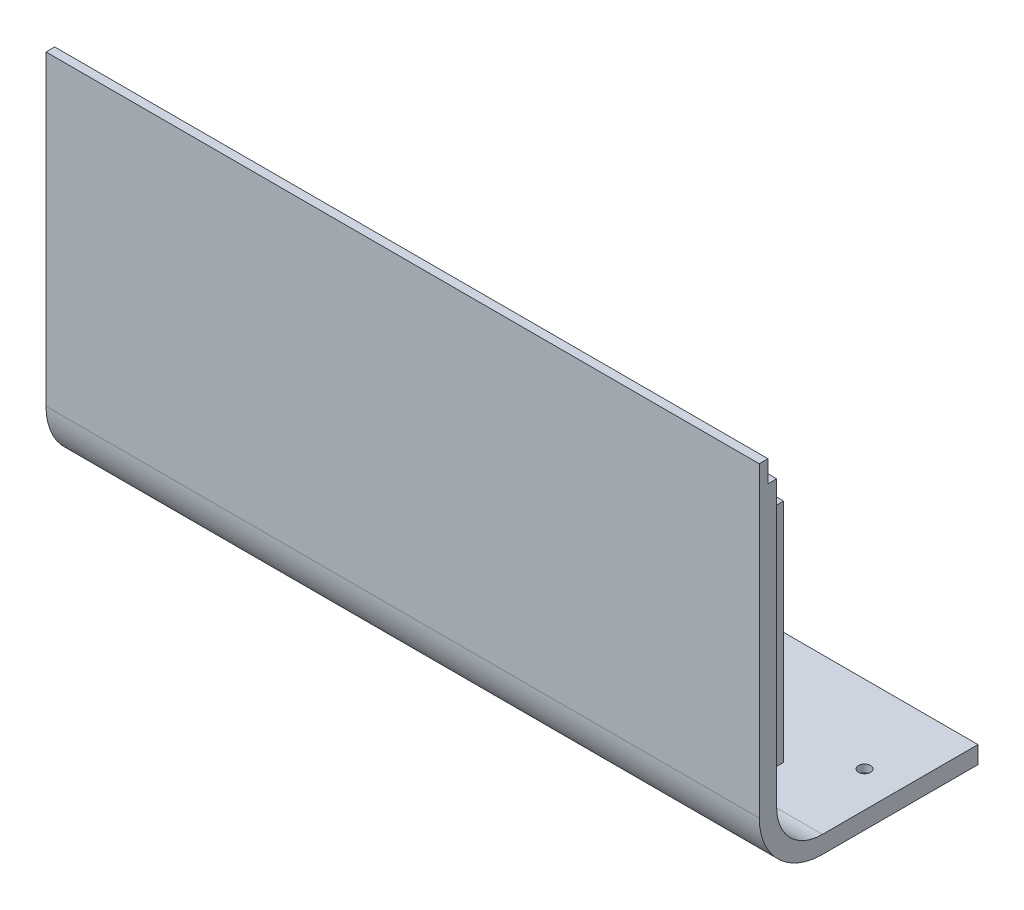
from build123d import *

# Parameters (mm, degrees)
SALIENTE_EXTRUIR1_DEPTH    = 131.1
CROQUIS3_R                 = 1.1
CORTAR_EXTRUIR1_DEPTH      = 289.575068223
CROQUIS4_R                 = 10.7
CROQUIS4_R_2               = 5.07
CROQUIS4_W                 = 121.1
CROQUIS4_H                 = 75.8
CROQUIS4_W_2               = 1.6
CROQUIS4_H_2               = 10
CROQUIS4_W_3               = 10
CROQUIS4_H_3               = 10.6
CORTAR_EXTRUIR2_DEPTH      = 287.189954401
CROQUIS7_W                 = 1.36
CROQUIS7_H                 = 98
CROQUIS7_W_2               = 1.86
CROQUIS7_H_2               = 41.6
SALIENTE_EXTRUIR2_DEPTH    = 4.4
CROQUIS8_R                 = 2.27
CORTAR_EXTRUIR3_DEPTH      = 1.8
CORTAR_EXTRUIR4_START      = -1.8
CROQUIS9_R                 = 2.27
CORTAR_EXTRUIR4_DEPTH      = 1.8
CROQUIS10_R                = 11.9
CROQUIS10_R_2              = 10.7
CROQUIS10_W                = 12.4
CROQUIS10_H                = 13
CROQUIS10_W_2              = 10
CROQUIS10_H_2              = 10.6
SALIENTE_EXTRUIR4_DEPTH    = 8.6
REDONDEO2_R                = 1.28
CORTAR_EXTRUIR5_REACH      = 292.482
CORTAR_EXTRUIR5_END_RADIUS = 10.7
CROQUIS11_W                = 4
CROQUIS11_H                = 14
SALIENTE_EXTRUIR6_START    = 1
CROQUIS13_W                = 12.4
CROQUIS13_H                = 13
SALIENTE_EXTRUIR6_DEPTH    = 1
CROQUIS14_R                = 2.8
CROQUIS14_R_2              = 1.5
SALIENTE_EXTRUIR7_DEPTH    = 8.4
REDONDEO3_R                = 1.28
CROQUIS17_W                = 4.4
CROQUIS17_H                = 0.4
CORTAR_EXTRUIR6_DEPTH      = 285.106479335
REDONDEO4_R                = 1.6
CROQUIS19_R                = 1.12
SALIENTE_EXTRUIR8_DEPTH    = 8.6
REDONDEO5_R                = 1
CORTAR_EXTRUIR8_START      = -1.86
CROQUIS21_W                = 0.6
CROQUIS21_H                = 26
CORTAR_EXTRUIR8_DEPTH      = 1.86
CROQUIS23_W                = 121.1
CROQUIS23_H                = 0.1
CORTAR_EXTRUIR9_DEPTH      = 287.189954401
CORTAR_EXTRUIR10_DEPTH     = 286.758027009


with BuildPart() as part:
    # Croquis2 → Saliente-Extruir1 (new body)
    with BuildSketch(Plane(origin=(0, 0, 0), x_dir=(0, 0, -1), z_dir=(1, 0, 0))):
        with BuildLine():
            Line((37, 0), (37, -3.2))
            Line((37, -3.2), (8.4, -3.2))
            ThreePointArc((8.4, -3.2), (0.197561338, 0.197561338), (-3.2, 8.4))
            Line((-3.2, 8.4), (-3.2, 239.6))
            ThreePointArc((-3.2, 239.6), (0.197561338, 247.802438662), (8.4, 251.2))
            Line((8.4, 251.2), (37, 251.2))
            Line((37, 251.2), (37, 248))
            Line((37, 248), (8.4, 248))
            ThreePointArc((8.4, 248), (2.460303038, 245.539696962), (0, 239.6))
            Line((0, 239.6), (0, 8.4))
            ThreePointArc((0, 8.4), (2.460303038, 2.460303038), (8.4, 0))
            Line((8.4, 0), (37, 0))
        make_face()
    extrude(amount=SALIENTE_EXTRUIR1_DEPTH)

    # Croquis3 → Cortar-Extruir1 (cut, through all)
    with BuildSketch(Plane(origin=(0, 251.2, 0), x_dir=(1, 0, 0), z_dir=(0, 1, 0))):
        with Locations(Location((6.55, 22.7, 0), (0, 0, 270))):
            Circle(CROQUIS3_R)
        with Locations(Location((124.55, 22.7, 0), (0, 0, 270))):
            Circle(CROQUIS3_R)
    extrude(amount=-CORTAR_EXTRUIR1_DEPTH, mode=Mode.SUBTRACT)

    # Croquis4 → Cortar-Extruir2 (cut, through all)
    with BuildSketch(Plane.XY.offset(3.2)):
        with Locations((17, 79.6)):
            Circle(CROQUIS4_R)
        with Locations((65.55, 113.5)):
            Circle(CROQUIS4_R_2)
        with Locations((65.55, 196.1)):
            Rectangle(CROQUIS4_W, CROQUIS4_H)
        with Locations((9.2, 112)):
            Rectangle(CROQUIS4_W_2, CROQUIS4_H_2)
        with Locations((45.7, 91.4)):
            Rectangle(CROQUIS4_W_3, CROQUIS4_H_3)
        with Locations((5.8, 112)):
            Rectangle(CROQUIS4_W_2, CROQUIS4_H_2)
        with Locations((12.6, 112)):
            Rectangle(CROQUIS4_W_2, CROQUIS4_H_2)
        with Locations((16, 112)):
            Rectangle(CROQUIS4_W_2, CROQUIS4_H_2)
        with Locations((19.4, 112)):
            Rectangle(CROQUIS4_W_2, CROQUIS4_H_2)
        with Locations((22.8, 112)):
            Rectangle(CROQUIS4_W_2, CROQUIS4_H_2)
        with Locations((26.2, 112)):
            Rectangle(CROQUIS4_W_2, CROQUIS4_H_2)
        with Locations((29.6, 112)):
            Rectangle(CROQUIS4_W_2, CROQUIS4_H_2)
        with Locations((33, 112)):
            Rectangle(CROQUIS4_W_2, CROQUIS4_H_2)
        with Locations((36.4, 112)):
            Rectangle(CROQUIS4_W_2, CROQUIS4_H_2)
        with Locations((39.8, 112)):
            Rectangle(CROQUIS4_W_2, CROQUIS4_H_2)
        with Locations((43.2, 112)):
            Rectangle(CROQUIS4_W_2, CROQUIS4_H_2)
        with Locations((46.6, 112)):
            Rectangle(CROQUIS4_W_2, CROQUIS4_H_2)
        with Locations((50, 112)):
            Rectangle(CROQUIS4_W_2, CROQUIS4_H_2)
    extrude(amount=-CORTAR_EXTRUIR2_DEPTH, mode=Mode.SUBTRACT)

    # Croquis7 → Saliente-Extruir2 (add)
    with BuildSketch(Plane(origin=(0, 0, 0), x_dir=(-1, 0, 0), z_dir=(0, 0, -1))):
        Polygon((-127.46, 125.3), (-127.96, 125.3), (-127.96, 66.3), (-127.46, 66.3), (-126.1, 66.3), (-126.1, 125.3), align=None)
        with Locations((-126.78, 185)):
            Rectangle(CROQUIS7_W, CROQUIS7_H)
        with Locations((-4.32, 185)):
            Rectangle(CROQUIS7_W, CROQUIS7_H)
        Polygon((-3.64, 125.3), (-5, 125.3), (-5, 66.3), (-3.64, 66.3), (-3.14, 66.3), (-3.14, 125.3), align=None)
        with Locations((-127.03, 32.7)):
            Rectangle(CROQUIS7_W_2, CROQUIS7_H_2)
        with Locations((-4.07, 32.7)):
            Rectangle(CROQUIS7_W_2, CROQUIS7_H_2)
    extrude(amount=SALIENTE_EXTRUIR2_DEPTH)

    # Croquis8 → Cortar-Extruir3 (cut)
    with BuildSketch(Plane(origin=(0, 251.2, 0), x_dir=(1, 0, 0), z_dir=(0, 1, 0))):
        with Locations(Location((6.55, 22.7, 0), (0, 0, 270))):
            Circle(CROQUIS8_R)
        with Locations(Location((124.55, 22.7, 0), (0, 0, 270))):
            Circle(CROQUIS8_R)
    extrude(amount=-CORTAR_EXTRUIR3_DEPTH, mode=Mode.SUBTRACT)

    # Croquis9 → Cortar-Extruir4 (cut)
    with BuildSketch(Plane.XZ.offset(3.2).offset(CORTAR_EXTRUIR4_START)):
        with Locations(Location((124.55, -22.7, 0), (0, 0, 90))):
            Circle(CROQUIS9_R)
        with Locations(Location((6.55, -22.7, 0), (0, 0, 90))):
            Circle(CROQUIS9_R)
    extrude(amount=CORTAR_EXTRUIR4_DEPTH, mode=Mode.SUBTRACT)

    # Croquis10 → Saliente-Extruir4 (add)
    # profile 1 of 2: a face of its own
    with BuildSketch(Plane(origin=(0, 0, 0), x_dir=(-1, 0, 0), z_dir=(0, 0, -1))):
        with Locations(Location((-17, 79.6, 0), (0, 0, 180))):
            Circle(CROQUIS10_R)
        with Locations(Location((-17, 79.6, 0), (0, 0, 180))):
            Circle(CROQUIS10_R_2, mode=Mode.SUBTRACT)
    # profile 2 of 2: a face of its own
    with BuildSketch(Plane(origin=(0, 0, 0), x_dir=(-1, 0, 0), z_dir=(0, 0, -1))):
        with Locations((-45.7, 91.4)):
            Rectangle(CROQUIS10_W, CROQUIS10_H)
        with Locations((-45.7, 91.4)):
            Rectangle(CROQUIS10_W_2, CROQUIS10_H_2, mode=Mode.SUBTRACT)
    extrude(amount=SALIENTE_EXTRUIR4_DEPTH)

    # Redondeo2
    redondeo2_edges = [part.edges().sort_by_distance(p)[0] for p in [
        (40.7, 86.1, -2.7),
        (40.7, 96.7, -2.7),
        (50.7, 96.7, -2.7),
        (50.7, 86.1, -2.7),
    ]]
    fillet(redondeo2_edges, radius=REDONDEO2_R)

    # Cortar-Extruir5: up to this cylinder (the profile starts outside it)
    cortar_extruir5_end = Plane(origin=(17, 79.6, -4.3), z_dir=(0, 0, 1)) * Cylinder(CORTAR_EXTRUIR5_END_RADIUS, 607.364, mode=Mode.PRIVATE)
    # Croquis11 → Cortar-Extruir5 (cut, up to the surface)
    with BuildSketch(Plane.ZY.offset(10), mode=Mode.PRIVATE) as cortar_extruir5_sk1:
        with Locations((-4.3, 79.6)):
            Rectangle(CROQUIS11_W, CROQUIS11_H)
    cortar_extruir5_tool1 = extrude(cortar_extruir5_sk1.sketch, amount=-CORTAR_EXTRUIR5_REACH, mode=Mode.PRIVATE) - cortar_extruir5_end
    add(cortar_extruir5_tool1.solids().sort_by_distance((-10, 79.6, -4.3))[0], mode=Mode.SUBTRACT)

    # Croquis13 → Saliente-Extruir6 (add)
    with BuildSketch(Plane(origin=(0, 0, -8.6), x_dir=(-1, 0, 0), z_dir=(0, 0, -1)).offset(SALIENTE_EXTRUIR6_START)):
        with Locations((-45.7, 91.4)):
            Rectangle(CROQUIS13_W, CROQUIS13_H)
        with BuildLine():
            ThreePointArc((-49.42, 86.1), (-50.32509668, 86.47490332), (-50.7, 87.38))
            Line((-50.7, 87.38), (-50.7, 95.42))
            ThreePointArc((-50.7, 95.42), (-50.32509668, 96.32509668), (-49.42, 96.7))
            Line((-49.42, 96.7), (-41.98, 96.7))
            ThreePointArc((-41.98, 96.7), (-41.07490332, 96.32509668), (-40.7, 95.42))
            Line((-40.7, 95.42), (-40.7, 87.38))
            ThreePointArc((-40.7, 87.38), (-41.07490332, 86.47490332), (-41.98, 86.1))
            Line((-41.98, 86.1), (-49.42, 86.1))
        make_face(mode=Mode.SUBTRACT)
    extrude(amount=-SALIENTE_EXTRUIR6_DEPTH)

    # Croquis14 → Saliente-Extruir7 (add)
    with BuildSketch(Plane(origin=(0, 0, 0), x_dir=(-1, 0, 0), z_dir=(0, 0, -1))):
        with Locations(Location((-65.55, 88.8, 0), (0, 0, 180))):
            Circle(CROQUIS14_R)
        with Locations((-65.55, 88.8)):
            Circle(CROQUIS14_R_2, mode=Mode.SUBTRACT)
    extrude(amount=SALIENTE_EXTRUIR7_DEPTH)

    # Redondeo3
    redondeo3_edges = [part.edges().sort_by_distance(p)[0] for p in [
        (62.75, 88.8, 0),
    ]]
    fillet(redondeo3_edges, radius=REDONDEO3_R)

    # Croquis17 → Cortar-Extruir6 (cut, through all)
    with BuildSketch(Plane(origin=(127.46, 0, 0), x_dir=(0, 0, -1), z_dir=(1, 0, 0))):
        with Locations((2.2, 233.8)):
            Rectangle(CROQUIS17_W, CROQUIS17_H)
    extrude(amount=-CORTAR_EXTRUIR6_DEPTH, mode=Mode.SUBTRACT)

    # Redondeo4
    redondeo4_edges = [part.edges().sort_by_distance(p)[0] for p in [
        (51.9, 91.4, 0),
        (39.5, 91.4, 0),
    ]]
    fillet(redondeo4_edges, radius=REDONDEO4_R)

    # Croquis19 → Saliente-Extruir8 (add)
    with BuildSketch(Plane(origin=(0, 0, 0), x_dir=(-1, 0, 0), z_dir=(0, 0, -1))):
        with Locations((-17, 91.5)):
            Circle(CROQUIS19_R)
        with Locations((-17, 67.7)):
            Circle(CROQUIS19_R)
    extrude(amount=SALIENTE_EXTRUIR8_DEPTH)

    # Redondeo5
    redondeo5_edges = [part.edges().sort_by_distance(p)[0] for p in [
        (28.9, 79.6, 0),
    ]]
    fillet(redondeo5_edges, radius=REDONDEO5_R)

    # Croquis21 → Cortar-Extruir8 (cut)
    with BuildSketch(Plane(origin=(127.96, 0, 0), x_dir=(0, 0, -1), z_dir=(1, 0, 0)).offset(CORTAR_EXTRUIR8_START)):
        with Locations((4.1, 79.3)):
            Rectangle(CROQUIS21_W, CROQUIS21_H)
    extrude(amount=CORTAR_EXTRUIR8_DEPTH, mode=Mode.SUBTRACT)

    # Croquis23 → Cortar-Extruir9 (cut, through all)
    with BuildSketch(Plane.XY.offset(3.2)):
        with Locations((65.55, 158.15)):
            Rectangle(CROQUIS23_W, CROQUIS23_H)
    extrude(amount=-CORTAR_EXTRUIR9_DEPTH, mode=Mode.SUBTRACT)

    # Croquis24 → Cortar-Extruir10 (cut, through all)
    with BuildSketch(Plane(origin=(131.1, 0, 0), x_dir=(0, 0, -1), z_dir=(1, 0, 0))):
        with BuildLine():
            Line((37, 60.8), (37, 248))
            Line((37, 248), (8.4, 248))
            ThreePointArc((8.4, 248), (2.460303038, 245.539696962), (0, 239.6))
            Line((0, 239.6), (0, 60.8))
            Line((0, 60.8), (37, 60.8))
        make_face()
        with BuildLine():
            Line((37, 248), (37, 251.2))
            Line((37, 251.2), (8.4, 251.2))
            ThreePointArc((8.4, 251.2), (0.197561338, 247.802438662), (-3.2, 239.6))
            Line((-3.2, 239.6), (-3.2, 64.8))
            Line((-3.2, 64.8), (-1.6, 64.8))
            Line((-1.6, 64.8), (-1.6, 60.8))
            Line((-1.6, 60.8), (0, 60.8))
            Line((0, 60.8), (0, 239.6))
            ThreePointArc((0, 239.6), (2.460303038, 245.539696962), (8.4, 248))
            Line((8.4, 248), (37, 248))
        make_face()
    extrude(amount=-CORTAR_EXTRUIR10_DEPTH, mode=Mode.SUBTRACT)


solid = part.part
